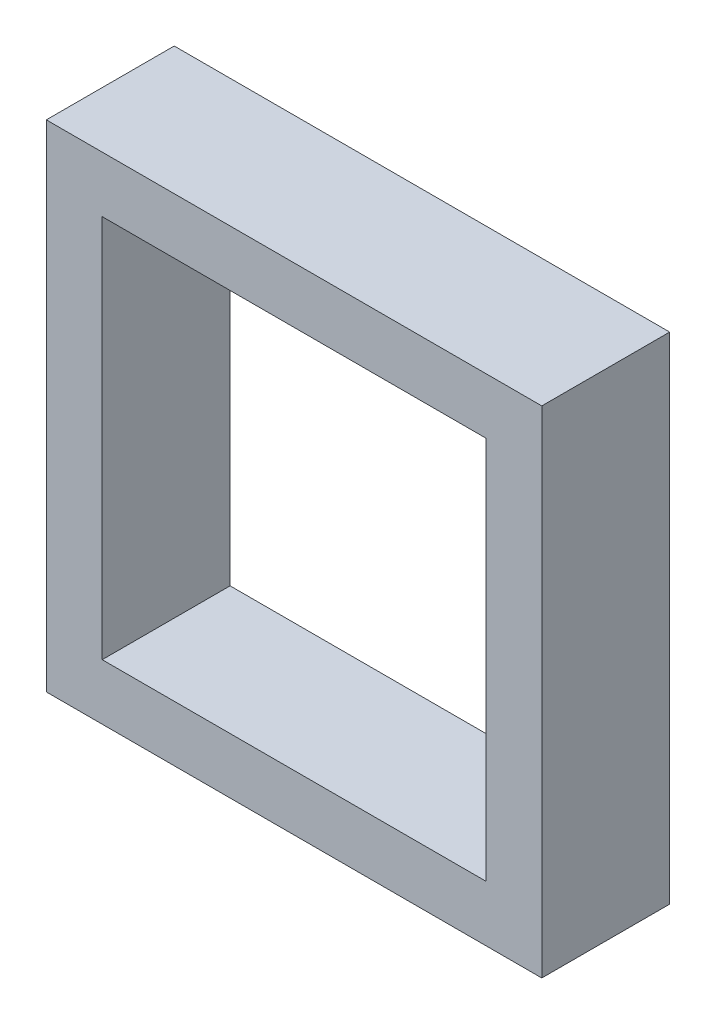
from build123d import *

# Parameters (mm, degrees)
SKETCH1_W           = 38.737878464
SKETCH1_H           = 38.737878464
SKETCH1_W_2         = 30
SKETCH1_H_2         = 30
BOSS_EXTRUDE1_DEPTH = 10


with BuildPart() as part:
    # Sketch1 → Boss-Extrude1 (new body)
    with BuildSketch(Plane.XY):
        Rectangle(SKETCH1_W, SKETCH1_H)
        Rectangle(SKETCH1_W_2, SKETCH1_H_2, mode=Mode.SUBTRACT)
    extrude(amount=BOSS_EXTRUDE1_DEPTH)


solid = part.part
